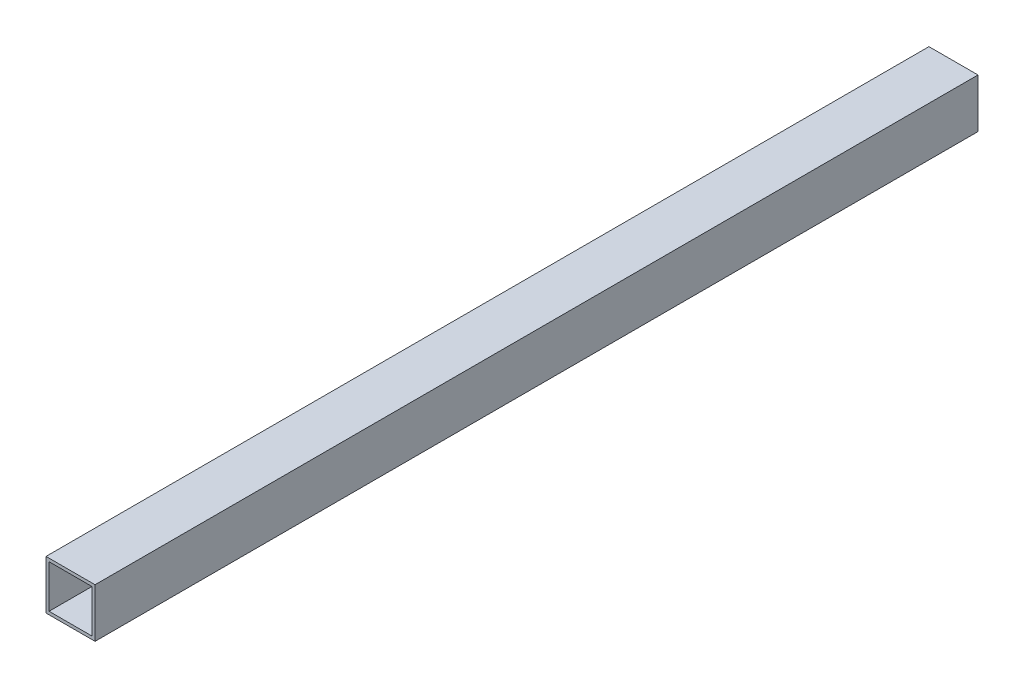
from build123d import *

# Parameters (mm, degrees)
SKETCH1_W           = 25.4
SKETCH1_H           = 25.4
SKETCH1_W_2         = 22.225
SKETCH1_H_2         = 22.225
EXTRUDE_THIN1_DEPTH = 457.2


with BuildPart() as part:
    # Sketch1 → Extrude-Thin1 (new body)
    with BuildSketch(Plane.XY):
        Rectangle(SKETCH1_W, SKETCH1_H)
        Rectangle(SKETCH1_W_2, SKETCH1_H_2, mode=Mode.SUBTRACT)
    extrude(amount=EXTRUDE_THIN1_DEPTH)


solid = part.part
